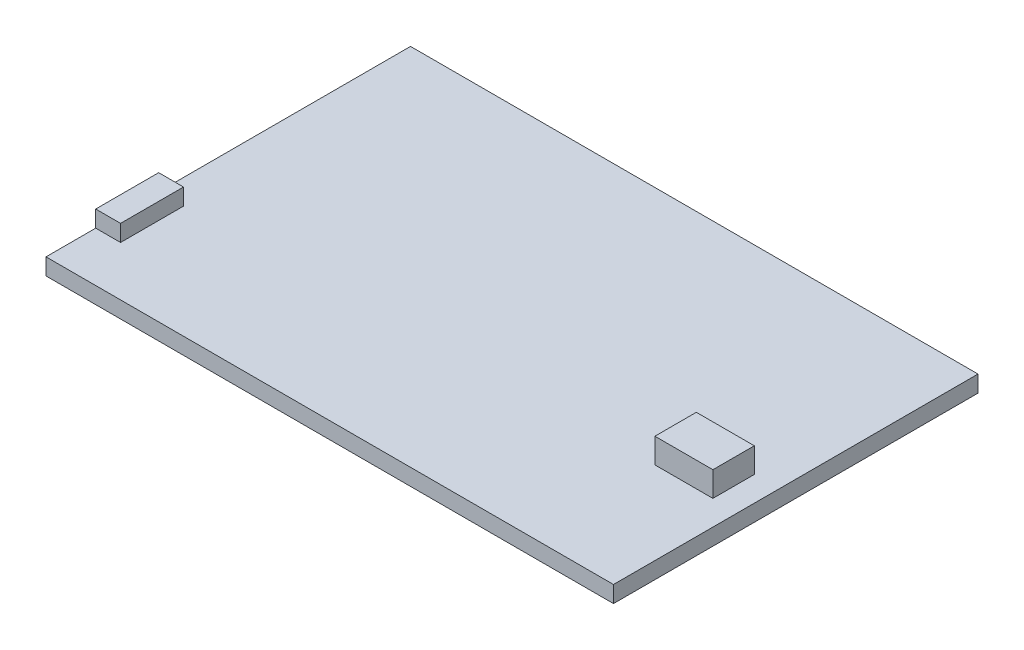
from build123d import *

# Parameters (mm, degrees)
SKETCH1_W           = 68.5
SKETCH1_H           = 44
BOSS_EXTRUDE1_DEPTH = 2
SKETCH2_W           = 7
SKETCH2_H           = 5
BOSS_EXTRUDE2_DEPTH = 3
SKETCH3_W           = 3
SKETCH3_H           = 7.6
BOSS_EXTRUDE3_DEPTH = 2


with BuildPart() as part:
    # Sketch1 → Boss-Extrude1 (new body)
    with BuildSketch(Plane(origin=(0, 0, 0), x_dir=(1, 0, 0), z_dir=(0, 1, 0))):
        Rectangle(SKETCH1_W, SKETCH1_H)
    extrude(amount=BOSS_EXTRUDE1_DEPTH)

    # Sketch2 → Boss-Extrude2 (add)
    with BuildSketch(Plane(origin=(0, 2, 0), x_dir=(1, 0, 0), z_dir=(0, 1, 0))):
        with Locations((27.75, -4.5)):
            Rectangle(SKETCH2_W, SKETCH2_H)
    extrude(amount=BOSS_EXTRUDE2_DEPTH)

    # Sketch3 → Boss-Extrude3 (add)
    with BuildSketch(Plane(origin=(0, 2, 0), x_dir=(1, 0, 0), z_dir=(0, 1, 0))):
        with Locations((-32.75, -12.2)):
            Rectangle(SKETCH3_W, SKETCH3_H)
    extrude(amount=BOSS_EXTRUDE3_DEPTH)


solid = part.part
